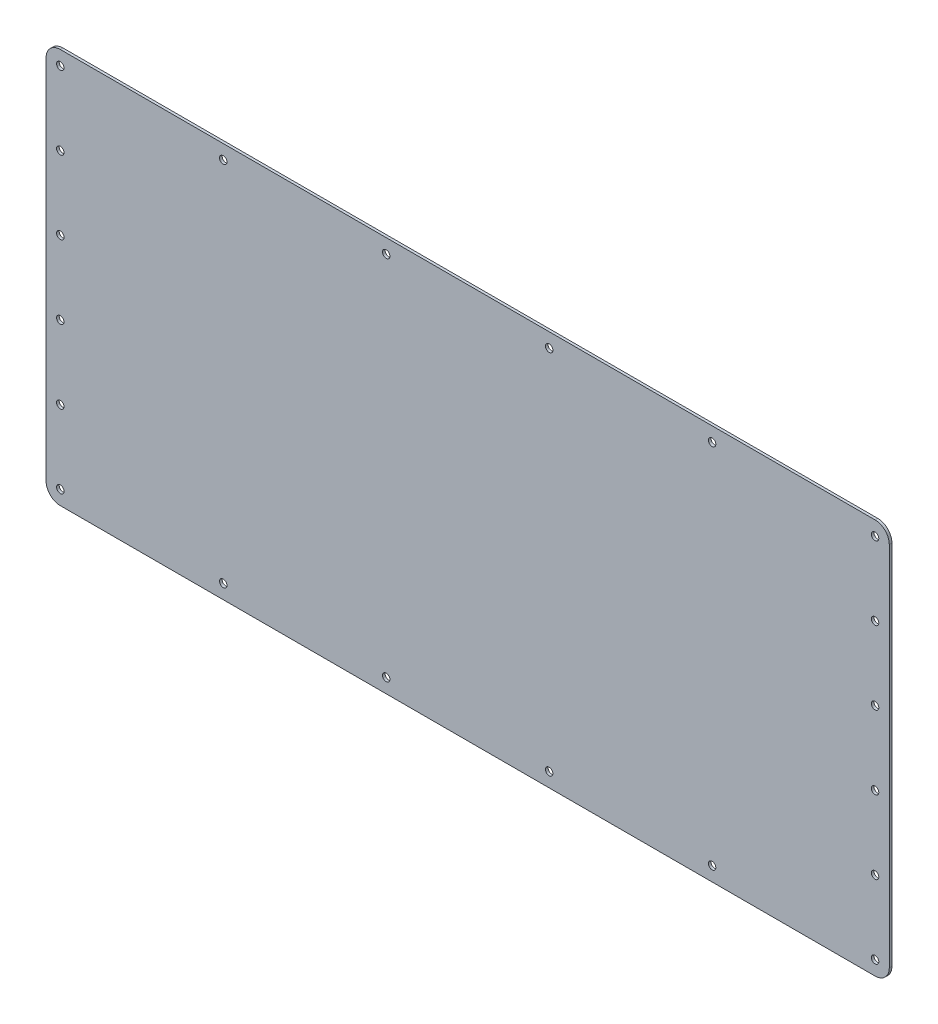
from build123d import *

# Parameters (mm, degrees)
SKETCH1_W              = 564.685680888
SKETCH1_H              = 264.578396166
BOSS_EXTRUDE1_DEPTH    = 1.76784
F_10_CLEARANCE_HOLE1_D = 4.9784
FILLET1_R              = 9.525


with BuildPart() as part:
    # Sketch1 → Boss-Extrude1 (new body)
    with BuildSketch(Plane.XY):
        Rectangle(SKETCH1_W, SKETCH1_H)
    extrude(amount=BOSS_EXTRUDE1_DEPTH)

    # #10 Clearance Hole1 (through all)
    with Locations(Plane.XY.offset(1.76784)):
        with Locations((-272.817840444, -122.764198083), (-272.817840444, -73.65851885), (-272.817840444, -24.552839617), (-272.817840444, 24.552839617), (-272.817840444, 73.65851885), (-272.817840444, 122.764198083), (-163.690704266, 122.764198083), (-54.563568089, 122.764198083), (-54.563568089, -122.764198083), (-163.690704266, -122.764198083)):
            f_10_clearance_hole1 = Hole(F_10_CLEARANCE_HOLE1_D / 2)

    # Mirror1: #10 Clearance Hole1 across plane
    add(f_10_clearance_hole1.mirror(Plane(origin=(0, 0, 0), x_dir=(0, 0, 1), z_dir=(1, 0, 0))), mode=Mode.SUBTRACT)

    # Fillet1
    fillet1_edges = [part.edges().sort_by_distance(p)[0] for p in [
        (282.342840444, -132.289198083, 0.88392),
        (-282.342840444, -132.289198083, 0.88392),
        (-282.342840444, 132.289198083, 0.88392),
        (282.342840444, 132.289198083, 0.88392),
    ]]
    fillet(fillet1_edges, radius=FILLET1_R)


solid = part.part
